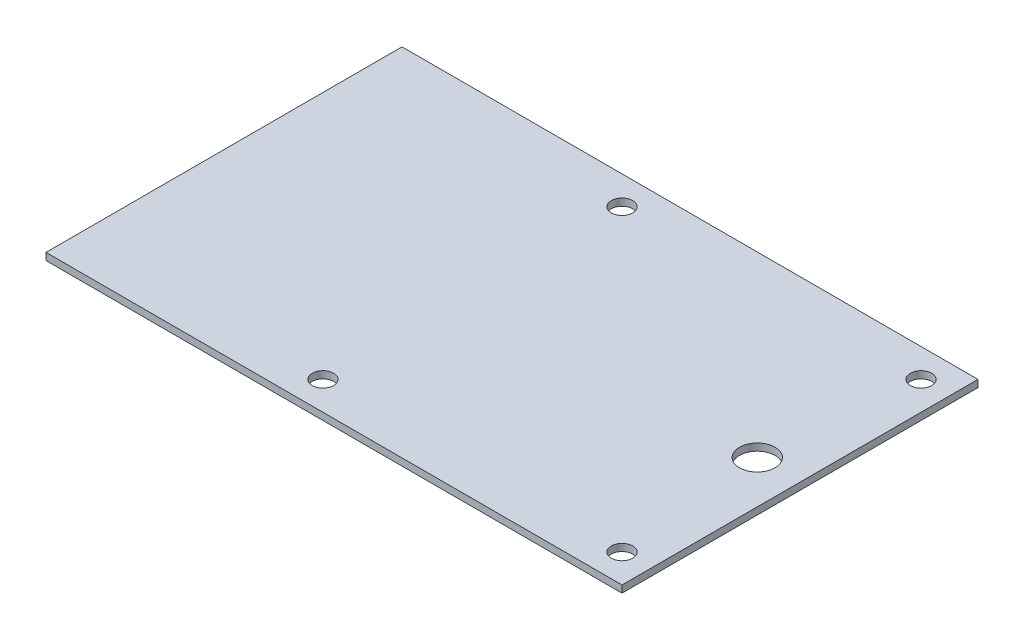
from build123d import *

# Parameters (mm, degrees)
ESBO_O1_W                = 80.9
ESBO_O1_H                = 50
RESSALTO_EXTRUS_O1_DEPTH = 1
ESBO_O2_R                = 1.5
ESBO_O2_R_2              = 2.5
CORTE_EXTRUS_O1_DEPTH    = 48.562616623


with BuildPart() as part:
    # Esboço1 → Ressalto-extrusão1 (new body)
    with BuildSketch(Plane(origin=(0, 0, 0), x_dir=(1, 0, 0), z_dir=(0, 1, 0))):
        Rectangle(ESBO_O1_W, ESBO_O1_H)
    extrude(amount=RESSALTO_EXTRUS_O1_DEPTH)

    # Esboço2 → Corte-extrusão1 (cut, through all)
    with BuildSketch(Plane(origin=(0, 1, 0), x_dir=(1, 0, 0), z_dir=(0, 1, 0))):
        with Locations(Location((36.45, 21, 0), (0, 0, 270))):
            Circle(ESBO_O2_R)
        with Locations(Location((36.45, -21, 0), (0, 0, 270))):
            Circle(ESBO_O2_R)
        with Locations(Location((-5.55, -21, 0), (0, 0, 270))):
            Circle(ESBO_O2_R)
        with Locations(Location((-5.55, 21, 0), (0, 0, 270))):
            Circle(ESBO_O2_R)
        with Locations(Location((34.45, 0, 0), (0, 0, 270))):
            Circle(ESBO_O2_R_2)
    extrude(amount=-CORTE_EXTRUS_O1_DEPTH, mode=Mode.SUBTRACT)


solid = part.part
